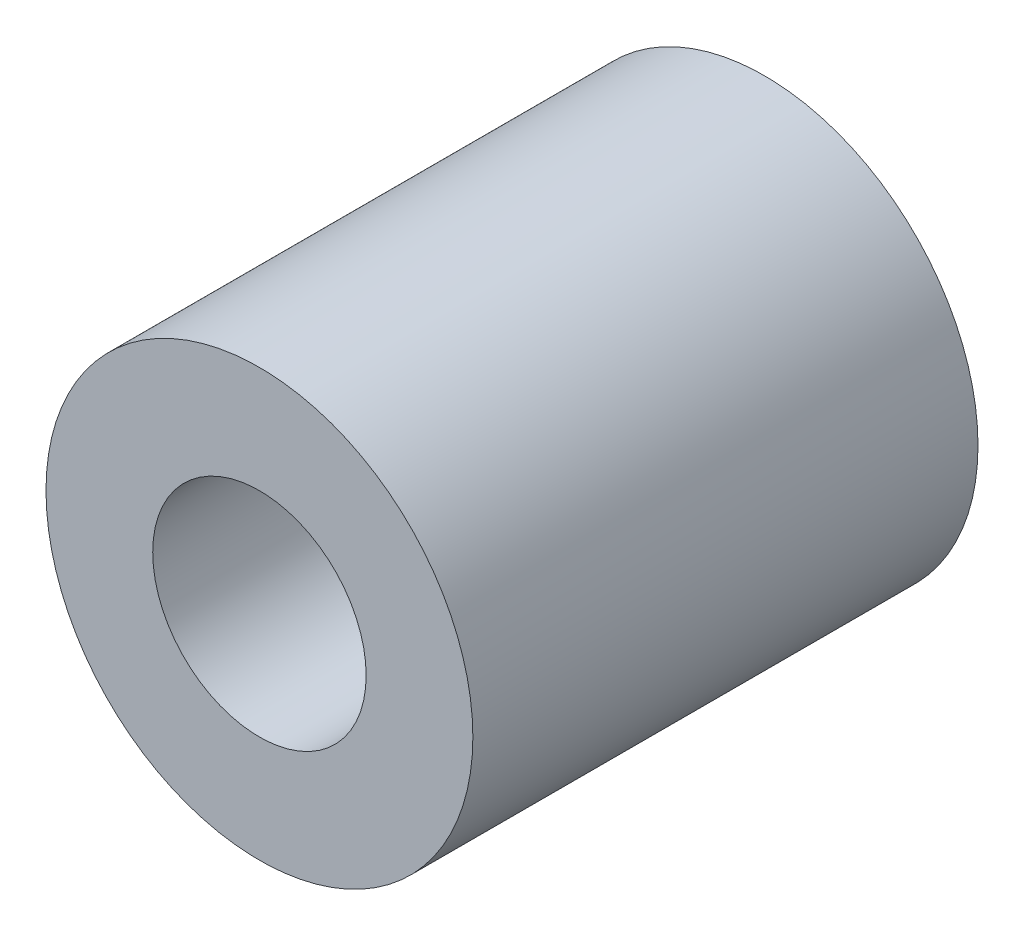
from build123d import *

# Parameters (mm, degrees)
SKETCH_1_R      = 4.5
SKETCH_1_R_2    = 2.25
EXTRUDE_1_DEPTH = 10.65


with BuildPart() as part:
    # 草图1 → 凸台-拉伸1 (new body)
    with BuildSketch(Plane.XY):
        Circle(SKETCH_1_R)
        Circle(SKETCH_1_R_2, mode=Mode.SUBTRACT)
    extrude(amount=EXTRUDE_1_DEPTH)


solid = part.part
